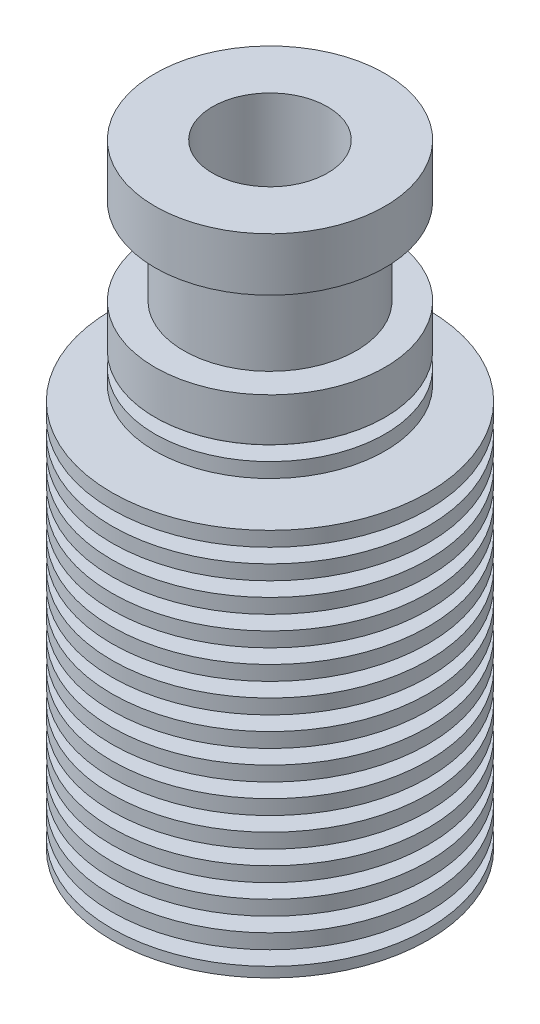
from build123d import *


with BuildPart() as part:
    # Croquis1 → Revolución2 (revolve)
    with BuildSketch(Plane.XY, mode=Mode.PRIVATE) as revoluci_n2_sk:
        Polygon((8, 42.7), (4, 42.7), (4, 36.2), (2.1, 34.605710701), (2.1, 15.427573211), (3, 15.1), (3, 0), (11, 0), (11, 30), (8, 30), (8, 33), (6, 33), (6, 39), (8, 39), align=None)
    revolve(revoluci_n2_sk.sketch.rotate(Axis((0, 0, 0), (0, 1, 0)), 90), axis=Axis((0, 0, 0), (0, 1, 0)))

    # Croquis2 → Cortar-Revolución1 (revolve, cut)
    with BuildSketch(Plane.XY, mode=Mode.PRIVATE) as cortar_revoluci_n1_sk:
        Polygon((6.561668068, 0.7), (11, 0.7), (11, 1.7), (6.474179405, 1.7), align=None)
        Polygon((6.297452304, 3.72), (6.384940968, 2.72), (11, 2.72), (11, 3.72), align=None)
        Polygon((6.120725204, 5.74), (6.208213867, 4.74), (11, 4.74), (11, 5.74), align=None)
        Polygon((5.943998104, 7.76), (6.031486767, 6.76), (11, 6.76), (11, 7.76), align=None)
        Polygon((5.767271003, 9.78), (5.854759667, 8.78), (11, 8.78), (11, 9.78), align=None)
        Polygon((5.590543903, 11.8), (5.678032566, 10.8), (11, 10.8), (11, 11.8), align=None)
        Polygon((5.413816803, 13.82), (5.501305466, 12.82), (11, 12.82), (11, 13.82), align=None)
        Polygon((5.237089702, 15.84), (5.324578366, 14.84), (11, 14.84), (11, 15.84), align=None)
        Polygon((5.060362602, 17.86), (5.147851265, 16.86), (11, 16.86), (11, 17.86), align=None)
        Polygon((4.883635502, 19.88), (4.971124165, 18.88), (11, 18.88), (11, 19.88), align=None)
        Polygon((4.706908401, 21.9), (4.794397065, 20.9), (11, 20.9), (11, 21.9), align=None)
        Polygon((4.530181301, 23.92), (4.617669964, 22.92), (11, 22.92), (11, 23.92), align=None)
        Polygon((4.353454201, 25.94), (4.440942864, 24.94), (11, 24.94), (11, 25.94), align=None)
        Polygon((4.1767271, 27.96), (4.264215764, 26.96), (11, 26.96), (11, 29.98), (4, 29.98), (4.087488664, 28.98), (8, 28.98), (8, 27.96), align=None)
    revolve(cortar_revoluci_n1_sk.sketch.rotate(Axis((0, 0, 0), (0, 1, 0)), 90), axis=Axis((0, 0, 0), (0, 1, 0)), mode=Mode.SUBTRACT)

    # Croquis3 → Cortar-Revolución4 (revolve, cut)
    with BuildSketch(Plane.XY):
        Polygon((10.994525772, 30), (11.094314794, 30), (11.094314794, 29.98), (7.992627906, 29.98), (7.992627906, 30), align=None)
    revolve(axis=Axis((0, 0, 0), (0, 1, 0)), mode=Mode.SUBTRACT)


solid = part.part
